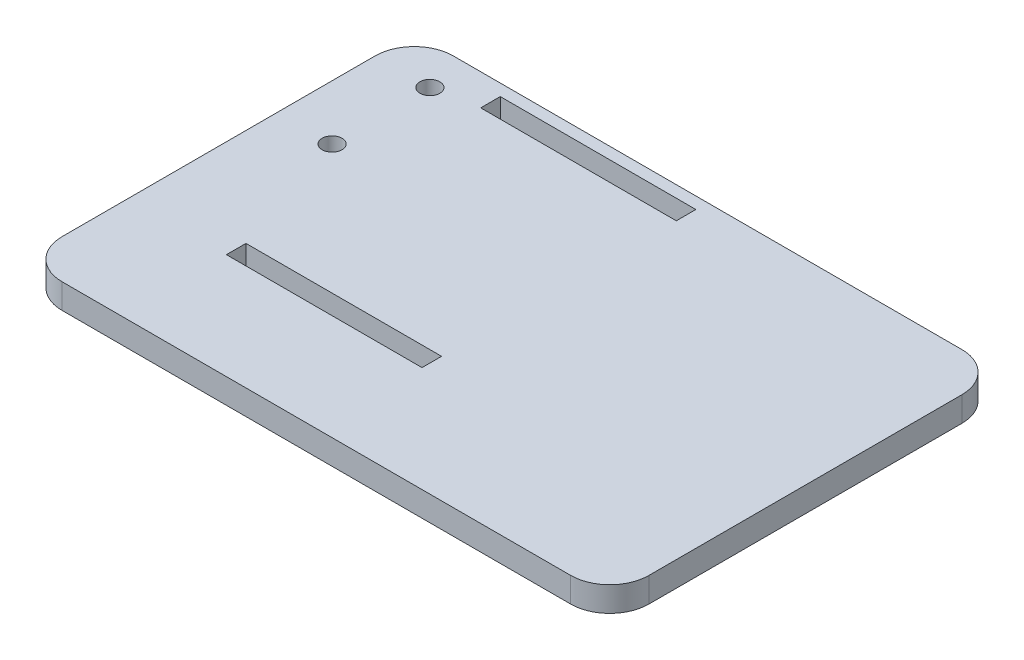
from build123d import *

# Parameters (mm, degrees)
SKETCH1_W           = 150
SKETCH1_H           = 100
SKETCH1_R           = 2.55
SKETCH1_W_2         = 50
SKETCH1_H_2         = 5
BOSS_EXTRUDE1_DEPTH = 6.35
FILLET1_R           = 10


with BuildPart() as part:
    # Sketch1 → Boss-Extrude1 (new body)
    with BuildSketch(Plane(origin=(0, 0, 0), x_dir=(1, 0, 0), z_dir=(0, 1, 0))):
        Rectangle(SKETCH1_W, SKETCH1_H)
        with Locations(Location((-61, 40, 0), (0, 0, 270))):
            Circle(SKETCH1_R, mode=Mode.SUBTRACT)
        with Locations(Location((-61, 15, 0), (0, 0, 270))):
            Circle(SKETCH1_R, mode=Mode.SUBTRACT)
        with Locations((-25, 44.5)):
            Rectangle(SKETCH1_W_2, SKETCH1_H_2, mode=Mode.SUBTRACT)
        with Locations((-25, -20.5)):
            Rectangle(SKETCH1_W_2, SKETCH1_H_2, mode=Mode.SUBTRACT)
    extrude(amount=BOSS_EXTRUDE1_DEPTH)

    # Fillet1
    fillet1_edges = [part.edges().sort_by_distance(p)[0] for p in [
        (75, 3.175, 50),
        (-75, 3.175, 50),
        (-75, 3.175, -50),
        (75, 3.175, -50),
    ]]
    fillet(fillet1_edges, radius=FILLET1_R)


solid = part.part
